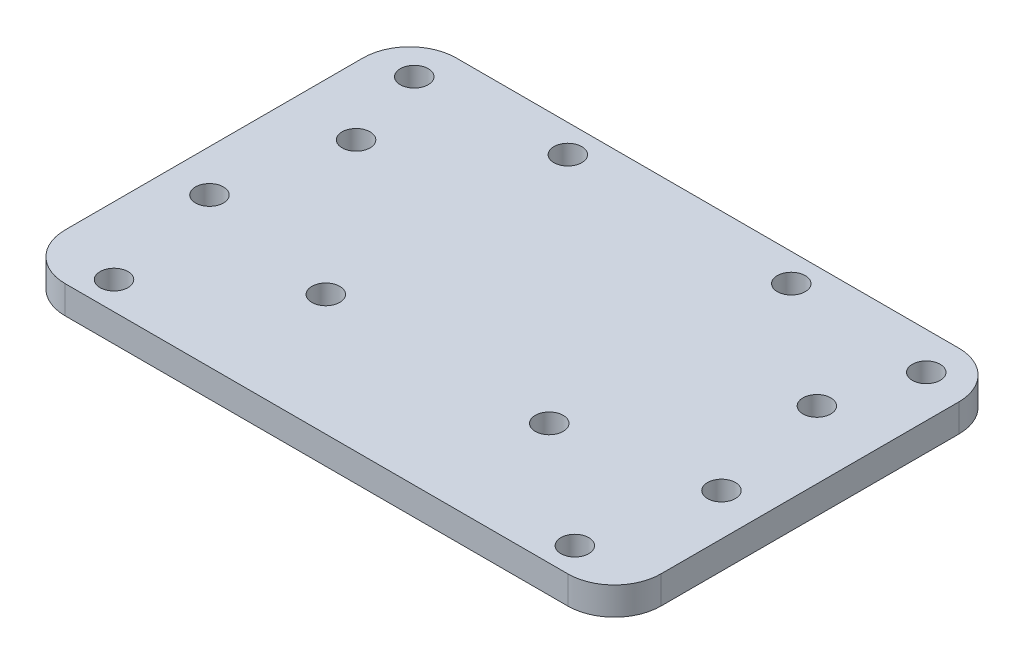
from build123d import *

# Parameters (mm, degrees)
SKETCH_1_W      = 64
SKETCH_1_H      = 42
SKETCH_1_R      = 1.5
EXTRUDE_1_DEPTH = 3
FILLET_2_R      = 5


with BuildPart() as part:
    # 草图1 → 凸台-拉伸1 (new body)
    with BuildSketch(Plane(origin=(0, 0, 0), x_dir=(1, 0, 0), z_dir=(0, 1, 0))):
        with Locations((0, -5)):
            Rectangle(SKETCH_1_W, SKETCH_1_H)
        with Locations(Location((-27.5, -10, 0), (0, 0, 270))):
            Circle(SKETCH_1_R, mode=Mode.SUBTRACT)
        with Locations(Location((-12, -13, 0), (0, 0, 270))):
            Circle(SKETCH_1_R, mode=Mode.SUBTRACT)
        with Locations(Location((12, -13, 0), (0, 0, 270))):
            Circle(SKETCH_1_R, mode=Mode.SUBTRACT)
        with Locations(Location((27.5, -10, 0), (0, 0, 270))):
            Circle(SKETCH_1_R, mode=Mode.SUBTRACT)
        with Locations(Location((-24.75, 3, 0), (0, 0, 270))):
            Circle(SKETCH_1_R, mode=Mode.SUBTRACT)
        with Locations(Location((-27.5, 12, 0), (0, 0, 270))):
            Circle(SKETCH_1_R, mode=Mode.SUBTRACT)
        with Locations(Location((-12, 13, 0), (0, 0, 270))):
            Circle(SKETCH_1_R, mode=Mode.SUBTRACT)
        with Locations(Location((24.75, 3, 0), (0, 0, 270))):
            Circle(SKETCH_1_R, mode=Mode.SUBTRACT)
        with Locations(Location((12, 13, 0), (0, 0, 270))):
            Circle(SKETCH_1_R, mode=Mode.SUBTRACT)
        with Locations(Location((27.5, 12, 0), (0, 0, 270))):
            Circle(SKETCH_1_R, mode=Mode.SUBTRACT)
        with Locations(Location((24.75, -23, 0), (0, 0, 270))):
            Circle(SKETCH_1_R, mode=Mode.SUBTRACT)
        with Locations(Location((-24.75, -23, 0), (0, 0, 270))):
            Circle(SKETCH_1_R, mode=Mode.SUBTRACT)
    extrude(amount=EXTRUDE_1_DEPTH)

    # 圆角2
    fillet_2_edges = [part.edges().sort_by_distance(p)[0] for p in [
        (-32, 1.5, -16),
        (32, 1.5, -16),
        (32, 1.5, 26),
        (-32, 1.5, 26),
    ]]
    fillet(fillet_2_edges, radius=FILLET_2_R)


solid = part.part
